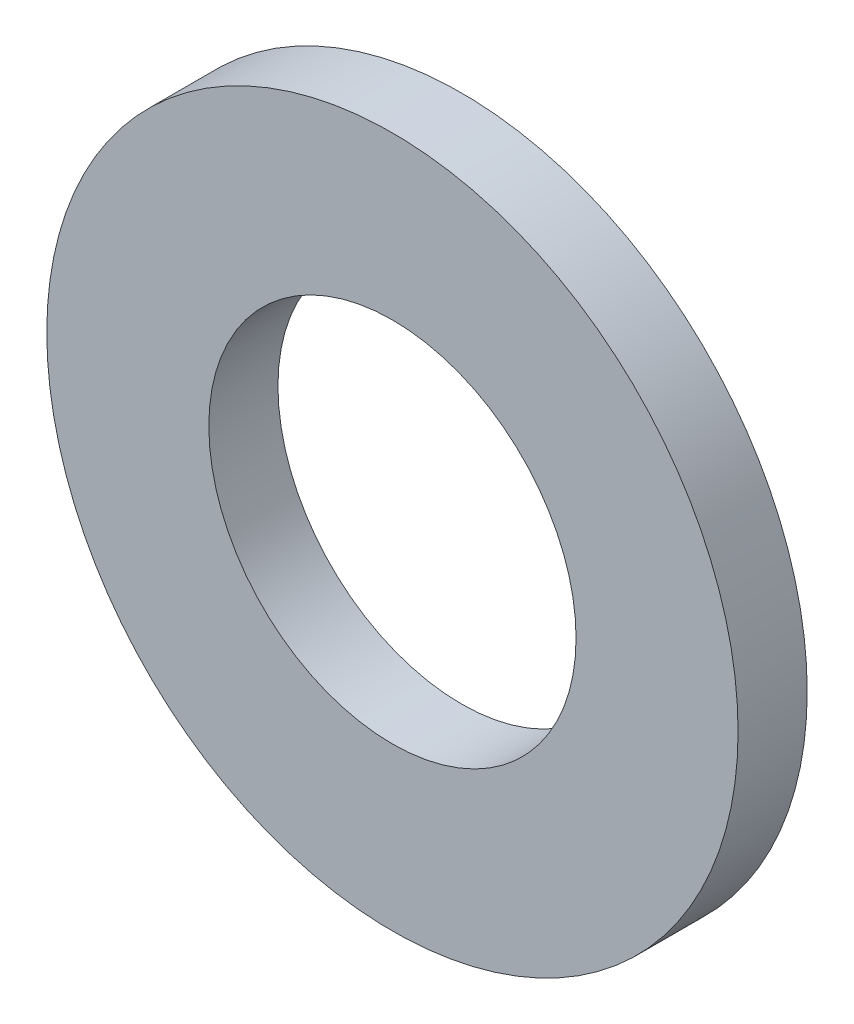
from build123d import *

# Parameters (mm, degrees)
SKETCH1_W = 3.75
SKETCH1_H = 1.6


with BuildPart() as part:
    # Sketch1 → Revolve1 (revolve)
    with BuildSketch(Plane.XZ, mode=Mode.PRIVATE) as revolve1_sk:
        with Locations((6.125, 0.8)):
            Rectangle(SKETCH1_W, SKETCH1_H)
    revolve(revolve1_sk.sketch.rotate(Axis((0, 0, 1.6), (0, 0, -1)), 180), axis=Axis((0, 0, 1.6), (0, 0, -1)))


solid = part.part
